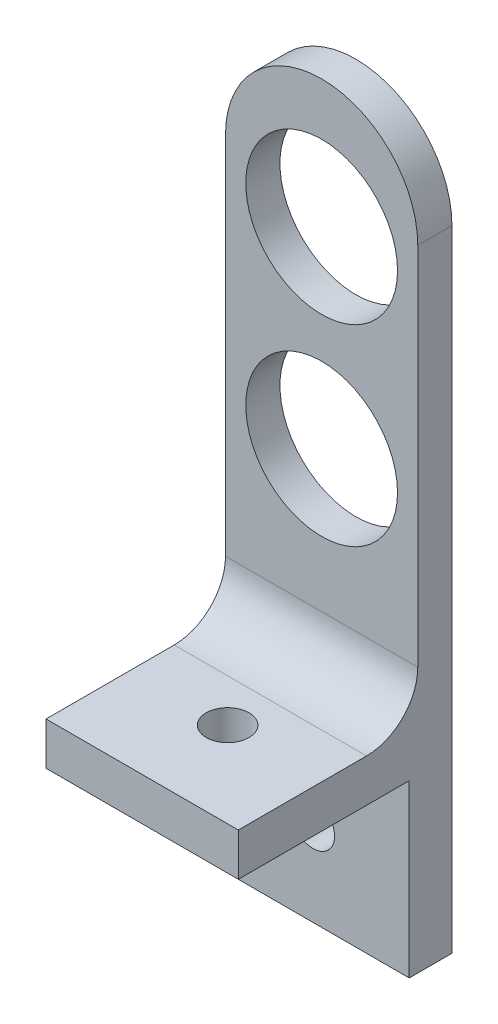
from build123d import *

# Parameters (mm, degrees)
SKETCH1_W           = 28.575
SKETCH1_H           = 76.2
SKETCH1_R           = 11.2776
BOSS_EXTRUDE1_DEPTH = 5.08
SKETCH1_3_W         = 28.575
SKETCH1_3_H         = 25.4
SKETCH1_3_R         = 3.1877
BOSS_EXTRUDE2_DEPTH = 6.35
SKETCH1_4_W         = 28.575
SKETCH1_4_H         = 6.35
BOSS_EXTRUDE3_DEPTH = 31.75
FILLET1_R           = 7.62
FILLET3_RADIUS      = 14.2875
FILLET3_LENGTH      = 5.08
SKETCH2_R           = 3.1877
CUT_EXTRUDE1_DEPTH  = 90.591839228


with BuildPart() as part:
    # Sketch1 → Boss-Extrude1 (new body)
    with BuildSketch(Plane.XY):
        with Locations((0, 15.875)):
            Rectangle(SKETCH1_W, SKETCH1_H)
        with Locations((0, 6.35)):
            Circle(SKETCH1_R, mode=Mode.SUBTRACT)
        with Locations((0, 34.925)):
            Circle(SKETCH1_R, mode=Mode.SUBTRACT)
    extrude(amount=BOSS_EXTRUDE1_DEPTH)



with BuildPart() as body_2:
    # Sketch1<3> → Boss-Extrude2 (new body)
    with BuildSketch(Plane.XY):
        with Locations((0, -41.275)):
            Rectangle(SKETCH1_3_W, SKETCH1_3_H)
        with Locations((0, -41.275)):
            Circle(SKETCH1_3_R, mode=Mode.SUBTRACT)
    extrude(amount=BOSS_EXTRUDE2_DEPTH)


with BuildPart() as part_1:
    add(part.part)

    add(body_2.part)  # Boss-Extrude3 merges body 2
    # Sketch1<4> → Boss-Extrude3 (add)
    with BuildSketch(Plane.XY):
        with Locations((0, -25.4)):
            Rectangle(SKETCH1_4_W, SKETCH1_4_H)
    extrude(amount=BOSS_EXTRUDE3_DEPTH)

    # Fillet1
    fillet1_edges = [part_1.edges().sort_by_distance(p)[0] for p in [
        (0, -22.225, 5.08),
    ]]
    fillet(fillet1_edges, radius=FILLET1_R)

    # Fillet3: full round fillet: the end face becomes a half cylinder, R = half its width
    fillet3_face = Plane((0, 53.975, 2.54), x_dir=(0, 0, 1), z_dir=(0, 1, 0))  # on the end face: x along it, z out of the body
    fillet3_slab = fillet3_face.offset(-FILLET3_RADIUS / 2) * Box(FILLET3_LENGTH, 2 * FILLET3_RADIUS, FILLET3_RADIUS, mode=Mode.PRIVATE)  # the body's end, R deep
    fillet3_round = Plane((0, 39.6875, 2.54), x_dir=(0, 1, 0), z_dir=(0, 0, 1)) * Cylinder(FILLET3_RADIUS, FILLET3_LENGTH, mode=Mode.PRIVATE)  # its axis R under the face
    add(fillet3_slab - fillet3_round, mode=Mode.SUBTRACT)

    # Sketch2 → Cut-Extrude1 (cut, through all)
    with BuildSketch(Plane.XZ.offset(28.575)):
        with Locations(Location((0, 19.05, 0), (0, 0, 270))):
            Circle(SKETCH2_R)
    extrude(amount=-CUT_EXTRUDE1_DEPTH, mode=Mode.SUBTRACT)


solid = part_1.part
